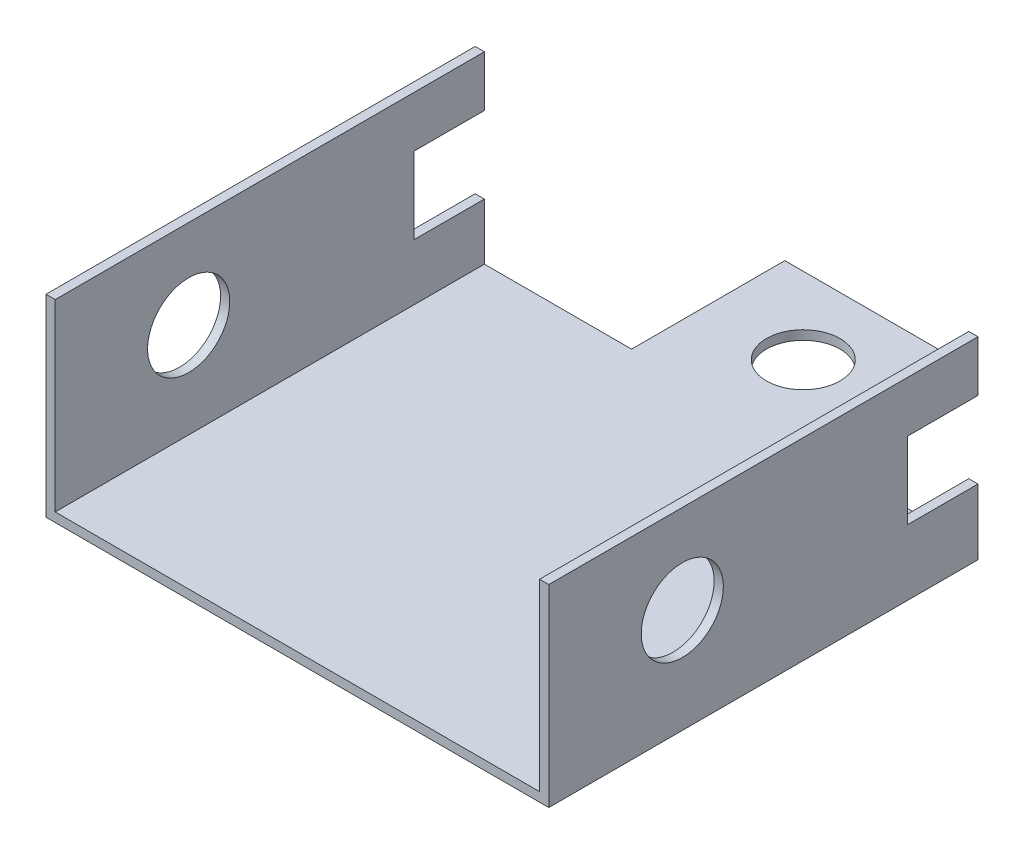
from build123d import *

# Parameters (mm, degrees)
SKETCH1_W           = 82
SKETCH1_H           = 70
BOSS_EXTRUDE1_DEPTH = 1.5
SKETCH2_W           = 1.5
SKETCH2_H           = 70
BOSS_EXTRUDE2_DEPTH = 30
SKETCH3_W           = 11.5
SKETCH3_H           = 12.5
CUT_EXTRUDE1_DEPTH  = 90
SKETCH4_R           = 6.7
CUT_EXTRUDE2_DEPTH  = 90
SKETCH5_W           = 31
SKETCH5_H           = 25
SKETCH5_R           = 6
BOSS_EXTRUDE3_DEPTH = 1.5


with BuildPart() as part:
    # Sketch1 → Boss-Extrude1 (new body)
    with BuildSketch(Plane(origin=(0, 0, 0), x_dir=(1, 0, 0), z_dir=(0, 1, 0))):
        with Locations((13.270768006, -23.069981584)):
            Rectangle(SKETCH1_W, SKETCH1_H)
    extrude(amount=BOSS_EXTRUDE1_DEPTH)

    # Sketch2 → Boss-Extrude2 (add)
    with BuildSketch(Plane(origin=(0, 1.5, 0), x_dir=(1, 0, 0), z_dir=(0, 1, 0))):
        with Locations((53.520768006, -23.069981584)):
            Rectangle(SKETCH2_W, SKETCH2_H)
        with Locations((-26.979231994, -23.069981584)):
            Rectangle(SKETCH2_W, SKETCH2_H)
    extrude(amount=BOSS_EXTRUDE2_DEPTH)

    # Sketch3 → Cut-Extrude1 (cut)
    with BuildSketch(Plane(origin=(54.270768006, 0, 0), x_dir=(0, 0, -1), z_dir=(1, 0, 0))):
        with Locations((6.180018416, 16.95)):
            Rectangle(SKETCH3_W, SKETCH3_H)
    extrude(amount=-CUT_EXTRUDE1_DEPTH, mode=Mode.SUBTRACT)

    # Sketch4 → Cut-Extrude2 (cut)
    with BuildSketch(Plane(origin=(54.270768006, 0, 0), x_dir=(0, 0, -1), z_dir=(1, 0, 0))):
        with Locations((-36.301843463, 17)):
            Circle(SKETCH4_R)
    extrude(amount=-CUT_EXTRUDE2_DEPTH, mode=Mode.SUBTRACT)

    # Sketch5 → Boss-Extrude3 (add)
    with BuildSketch(Plane(origin=(0, 1.5, 0), x_dir=(1, 0, 0), z_dir=(0, 1, 0))):
        with Locations((13.270768006, 24.430018416)):
            Rectangle(SKETCH5_W, SKETCH5_H)
        with Locations(Location((13.270768006, 24.430018416, 0), (0, 0, 270))):
            Circle(SKETCH5_R, mode=Mode.SUBTRACT)
    extrude(amount=-BOSS_EXTRUDE3_DEPTH)


solid = part.part
